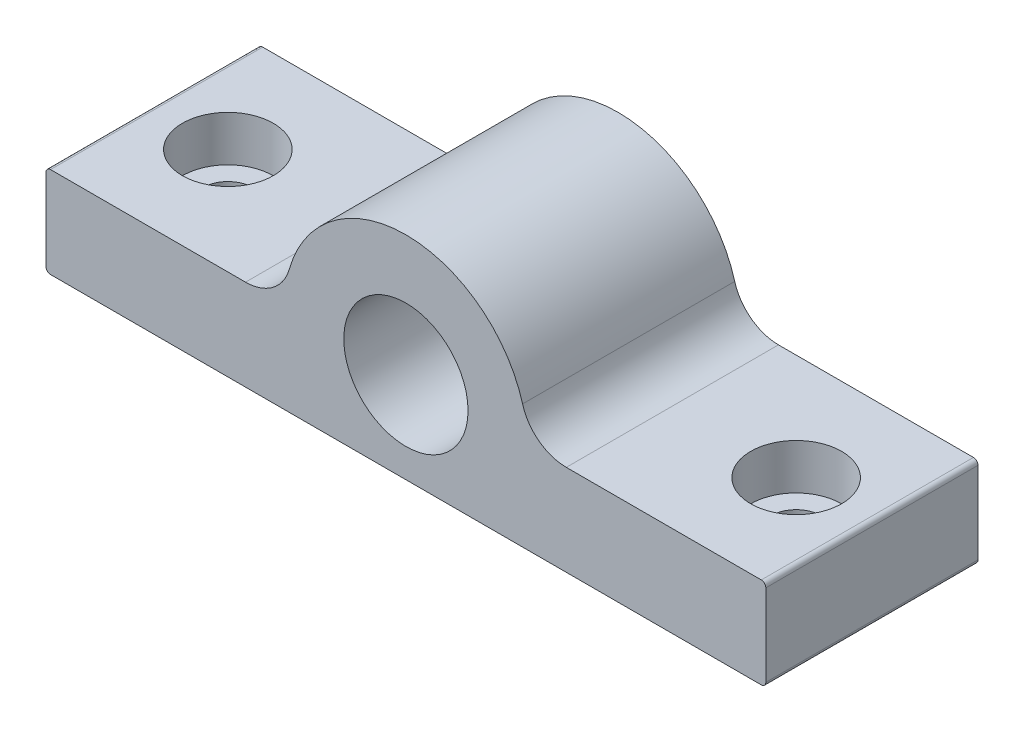
from build123d import *

# Parameters (mm, degrees)
SKETCH1_W           = 47.5
SKETCH1_H           = 14
BOSS_EXTRUDE1_DEPTH = 6
BOSS_EXTRUDE2_DEPTH = 14
SKETCH4_R           = 4.1
CUT_EXTRUDE1_DEPTH  = 52.461150395
SKETCH5_R           = 1.65
CUT_EXTRUDE2_DEPTH  = 51.162236792
SKETCH6_R           = 3
CUT_EXTRUDE3_DEPTH  = 3
FILLET1_R           = 3
FILLET2_R           = 0.3


with BuildPart() as part:
    # Sketch1 → Boss-Extrude1 (new body)
    with BuildSketch(Plane(origin=(0, 0, 0), x_dir=(1, 0, 0), z_dir=(0, 1, 0))):
        with Locations((23.75, 7)):
            Rectangle(SKETCH1_W, SKETCH1_H)
    extrude(amount=BOSS_EXTRUDE1_DEPTH)

    # Sketch3 → Boss-Extrude2 (add)
    with BuildSketch(Plane.XY):
        with BuildLine():
            Line((15.75, 2.184089353), (16.718725156, 2.184089353))
            Line((16.718725156, 2.184089353), (30.781274844, 2.184089353))
            Line((30.781274844, 2.184089353), (31.75, 2.184089353))
            Line((31.75, 2.184089353), (31.75, 6))
            ThreePointArc((31.75, 6), (23.75, 14), (15.75, 6))
            Line((15.75, 6), (15.75, 2.184089353))
        make_face()
    extrude(amount=-BOSS_EXTRUDE2_DEPTH)

    # Sketch4 → Cut-Extrude1 (cut, through all)
    with BuildSketch(Plane.XY):
        with Locations((23.75, 6)):
            Circle(SKETCH4_R)
    extrude(amount=-CUT_EXTRUDE1_DEPTH, mode=Mode.SUBTRACT)

    # Sketch5 → Cut-Extrude2 (cut, through all)
    with BuildSketch(Plane(origin=(0, 6, 0), x_dir=(1, 0, 0), z_dir=(0, 1, 0))):
        with Locations(Location((5, 7, 0), (0, 0, 270))):
            Circle(SKETCH5_R)
        with Locations(Location((42.5, 7, 0), (0, 0, 90))):
            Circle(SKETCH5_R)
    extrude(amount=-CUT_EXTRUDE2_DEPTH, mode=Mode.SUBTRACT)

    # Sketch6 → Cut-Extrude3 (cut)
    with BuildSketch(Plane(origin=(0, 6, 0), x_dir=(1, 0, 0), z_dir=(0, 1, 0))):
        with Locations(Location((5, 7, 0), (0, 0, 270))):
            Circle(SKETCH6_R)
        with Locations(Location((42.5, 7, 0), (0, 0, 90))):
            Circle(SKETCH6_R)
    extrude(amount=-CUT_EXTRUDE3_DEPTH, mode=Mode.SUBTRACT)

    # Fillet1
    fillet1_edges = [part.edges().sort_by_distance(p)[0] for p in [
        (15.75, 6, -7),
        (31.75, 6, -7),
    ]]
    fillet(fillet1_edges, radius=FILLET1_R)

    # Fillet2
    fillet2_edges = [part.edges().sort_by_distance(p)[0] for p in [
        (47.5, 6, -7),
        (0, 6, -7),
        (47.5, 0, -7),
        (0, 0, -7),
    ]]
    fillet(fillet2_edges, radius=FILLET2_R)


solid = part.part
